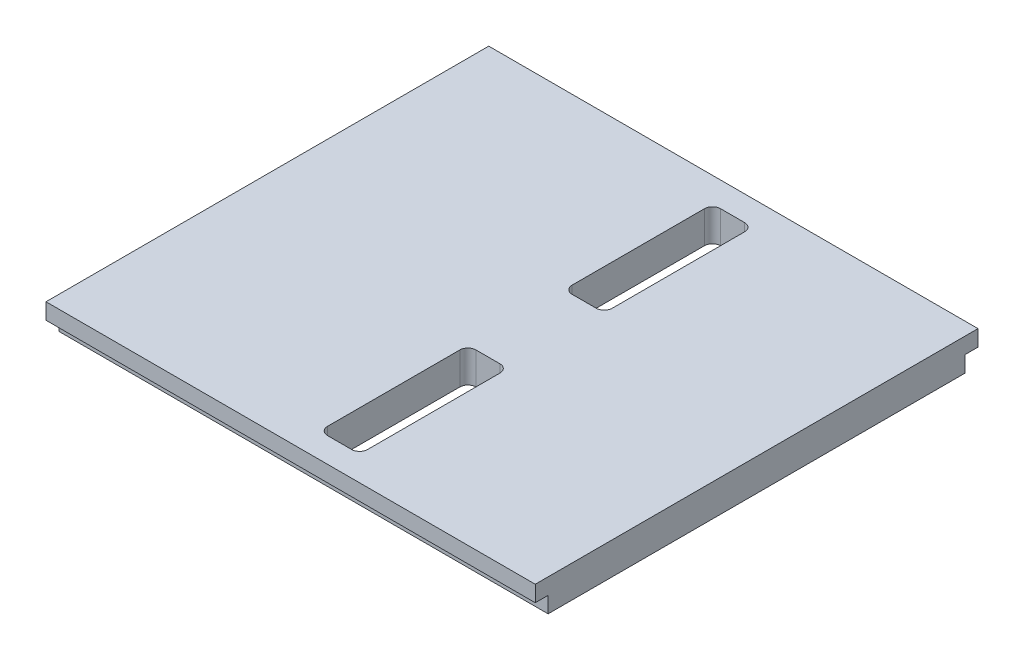
from build123d import *

# Parameters (mm, degrees)
SKETCH1_W           = 175.26
SKETCH1_H           = 12.7
BOSS_EXTRUDE1_DEPTH = 96.8375
SKETCH2_W           = 5.08
SKETCH2_H           = 6.35
CUT_EXTRUDE1_DEPTH  = 213.67191875
CUT_EXTRUDE2_DEPTH  = 6.35
SKETCH5_W           = 15.875
SKETCH5_H           = 58.7375
CUT_EXTRUDE4_DEPTH  = 132.216646453
FILLET1_R           = 3.175


with BuildPart() as part:
    # Sketch1 → Boss-Extrude1 (new, symmetric)
    with BuildSketch(Plane(origin=(0, 0, 0), x_dir=(0, 0, -1), z_dir=(1, 0, 0))):
        Rectangle(SKETCH1_W, SKETCH1_H)
    extrude(amount=BOSS_EXTRUDE1_DEPTH, both=True)

    # Sketch2 → Cut-Extrude1 (cut, through all)
    with BuildSketch(Plane(origin=(96.8375, 0, 0), x_dir=(0, 0, -1), z_dir=(1, 0, 0))):
        with Locations((-85.09, -3.175)):
            Rectangle(SKETCH2_W, SKETCH2_H)
        with Locations((85.09, -3.175)):
            Rectangle(SKETCH2_W, SKETCH2_H)
    extrude(amount=-CUT_EXTRUDE1_DEPTH, mode=Mode.SUBTRACT)

    # Sketch3 → Cut-Extrude2 (cut)
    with BuildSketch(Plane(origin=(0, -6.35, 0), x_dir=(1, 0, 0), z_dir=(0, 1, 0))):
        with BuildLine():
            Line((28.448, 11.2395), (41.402, 11.2395))
            ThreePointArc((41.402, 11.2395), (44.704, 7.9375), (41.402, 4.6355))
            Line((41.402, 4.6355), (41.402, -4.6355))
            ThreePointArc((41.402, -4.6355), (44.704, -7.9375), (41.402, -11.2395))
            Line((41.402, -11.2395), (28.448, -11.2395))
            ThreePointArc((28.448, -11.2395), (25.146, -7.9375), (28.448, -4.6355))
            Line((28.448, -4.6355), (28.448, 4.6355))
            ThreePointArc((28.448, 4.6355), (25.146, 7.9375), (28.448, 11.2395))
        make_face()
        with BuildLine():
            Line((-22.352, 11.2395), (-9.398, 11.2395))
            ThreePointArc((-9.398, 11.2395), (-6.096, 7.9375), (-9.398, 4.6355))
            Line((-9.398, 4.6355), (-9.398, -4.6355))
            ThreePointArc((-9.398, -4.6355), (-6.096, -7.9375), (-9.398, -11.2395))
            Line((-9.398, -11.2395), (-22.352, -11.2395))
            ThreePointArc((-22.352, -11.2395), (-25.654, -7.9375), (-22.352, -4.6355))
            Line((-22.352, -4.6355), (-22.352, 4.6355))
            ThreePointArc((-22.352, 4.6355), (-25.654, 7.9375), (-22.352, 11.2395))
        make_face()
    extrude(amount=CUT_EXTRUDE2_DEPTH, mode=Mode.SUBTRACT)

    # Sketch5 → Cut-Extrude4 (cut, through all)
    with BuildSketch(Plane(origin=(0, 6.35, 0), x_dir=(1, 0, 0), z_dir=(0, 1, 0))):
        with Locations((9.525, -48.41875)):
            Rectangle(SKETCH5_W, SKETCH5_H)
        with Locations((9.525, 48.41875)):
            Rectangle(SKETCH5_W, SKETCH5_H)
    extrude(amount=-CUT_EXTRUDE4_DEPTH, mode=Mode.SUBTRACT)

    # Fillet1
    fillet1_edges = [part.edges().sort_by_distance(p)[0] for p in [
        (1.5875, 0, -19.05),
        (1.5875, 0, -77.7875),
        (17.4625, 0, -77.7875),
        (17.4625, 0, -19.05),
        (1.5875, 0, 77.7875),
        (1.5875, 0, 19.05),
        (17.4625, 0, 19.05),
        (17.4625, 0, 77.7875),
    ]]
    fillet(fillet1_edges, radius=FILLET1_R)


solid = part.part
